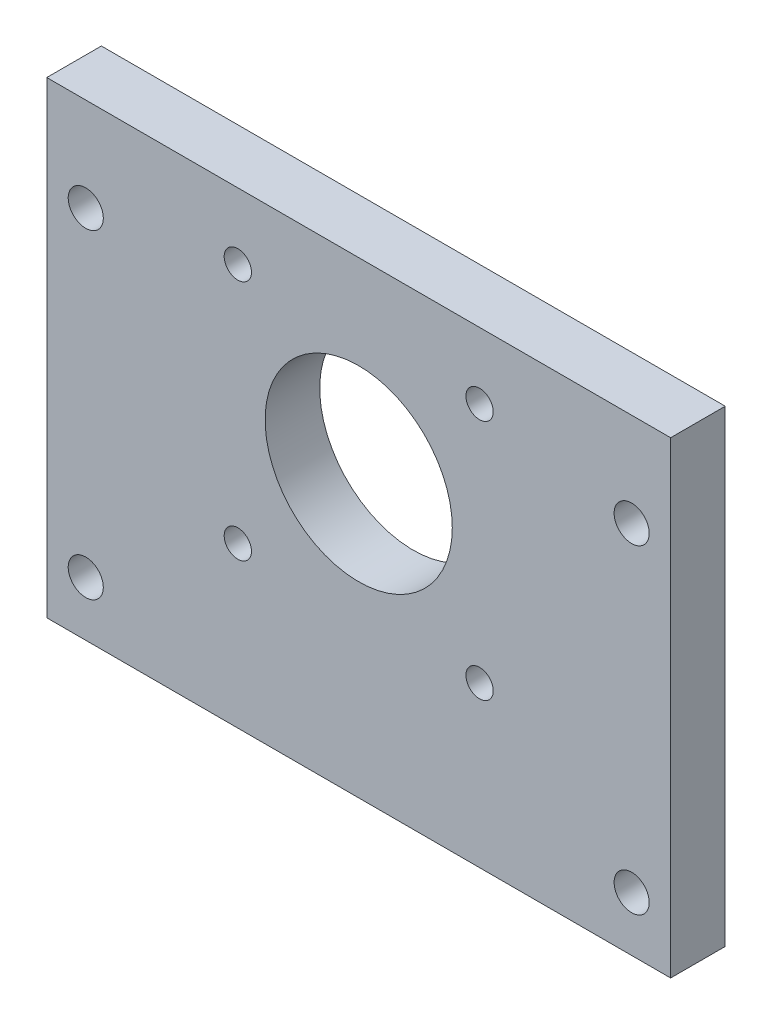
from build123d import *

# Parameters (mm, degrees)
Z_MOTOR_MOUNT_W   = 80
Z_MOTOR_MOUNT_H   = 60
Z_MOTOR_MOUNT_R   = 12
Z_MOTOR_MOUNT_R_2 = 1.75
Z_MOTOR_MOUNT_R_3 = 2.25
F_7MM_DEPTH       = 7


with BuildPart() as part:
    # 外形与孔位_z_motor_mount → 板厚_7mm (new body)
    with BuildSketch(Plane.XY):
        with Locations((40, 30)):
            Rectangle(Z_MOTOR_MOUNT_W, Z_MOTOR_MOUNT_H)
        with Locations((40, 36)):
            Circle(Z_MOTOR_MOUNT_R, mode=Mode.SUBTRACT)
        with Locations((24.5, 20.5)):
            Circle(Z_MOTOR_MOUNT_R_2, mode=Mode.SUBTRACT)
        with Locations((24.5, 51.5)):
            Circle(Z_MOTOR_MOUNT_R_2, mode=Mode.SUBTRACT)
        with Locations((55.5, 20.5)):
            Circle(Z_MOTOR_MOUNT_R_2, mode=Mode.SUBTRACT)
        with Locations((55.5, 51.5)):
            Circle(Z_MOTOR_MOUNT_R_2, mode=Mode.SUBTRACT)
        with Locations((5, 7)):
            Circle(Z_MOTOR_MOUNT_R_3, mode=Mode.SUBTRACT)
        with Locations((5, 48)):
            Circle(Z_MOTOR_MOUNT_R_3, mode=Mode.SUBTRACT)
        with Locations((75, 7)):
            Circle(Z_MOTOR_MOUNT_R_3, mode=Mode.SUBTRACT)
        with Locations((75, 48)):
            Circle(Z_MOTOR_MOUNT_R_3, mode=Mode.SUBTRACT)
    extrude(amount=F_7MM_DEPTH)


solid = part.part
